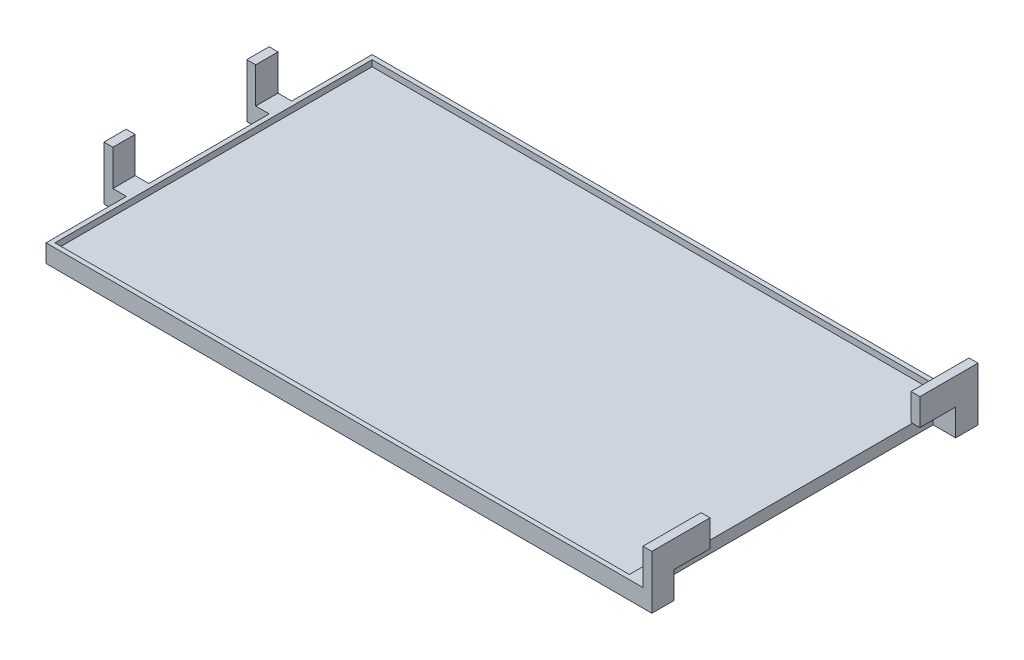
from build123d import *

# Parameters (mm, degrees)
ESQUISSE1_W             = 130.51
ESQUISSE1_H             = 72.96
BOSS_EXTRU_4_DEPTH      = 4
ESQUISSE5_W             = 128.51
ESQUISSE5_H             = 70.96
ENL_V_MAT_EXTRU_1_DEPTH = 1.36
ESQUISSE6_W             = 60.96
ESQUISSE6_H             = 1.36
ENL_V_MAT_EXTRU_2_DEPTH = 149.70104808
ESQUISSE12_W            = 5.045005
ESQUISSE12_H            = 5
BOSS_EXTRU_10_DEPTH     = 4
ESQUISSE14_W            = 2
ESQUISSE14_H            = 5
BOSS_EXTRU_11_DEPTH     = 8
ESQUISSE15_W            = 2
ESQUISSE15_H            = 6
BOSS_EXTRU_12_DEPTH     = 8
ESQUISSE16_W            = 2
ESQUISSE16_H            = 6
BOSS_EXTRU_13_DEPTH     = 8
ESQUISSE17_W            = 5.045005
ESQUISSE17_H            = 5
BOSS_EXTRU_14_DEPTH     = 4
ESQUISSE19_W            = 2
ESQUISSE19_H            = 5
BOSS_EXTRU_15_DEPTH     = 8


with BuildPart() as part:
    # Esquisse1 → Boss.-Extru.4 (new body)
    with BuildSketch(Plane(origin=(0, 0, 0), x_dir=(1, 0, 0), z_dir=(0, 1, 0))):
        with Locations((65.255, 36.48)):
            Rectangle(ESQUISSE1_W, ESQUISSE1_H)
    extrude(amount=BOSS_EXTRU_4_DEPTH)

    # Esquisse5 → Enlèv. mat.-Extru.1 (cut)
    with BuildSketch(Plane(origin=(0, 4, 0), x_dir=(1, 0, 0), z_dir=(0, 1, 0))):
        with Locations((65.255, 36.48)):
            Rectangle(ESQUISSE5_W, ESQUISSE5_H)
    extrude(amount=-ENL_V_MAT_EXTRU_1_DEPTH, mode=Mode.SUBTRACT)

    # Esquisse6 → Enlèv. mat.-Extru.2 (cut, through all)
    with BuildSketch(Plane.ZY.offset(-129.51)):
        with Locations((-36.48, 3.32)):
            Rectangle(ESQUISSE6_W, ESQUISSE6_H)
    extrude(amount=-ENL_V_MAT_EXTRU_2_DEPTH, mode=Mode.SUBTRACT)

    # Esquisse12 → Boss.-Extru.10 (add)
    with BuildSketch(Plane.XZ):
        with Locations((133.0325025, -70.46)):
            Rectangle(ESQUISSE12_W, ESQUISSE12_H)
        with Locations((133.0325025, -2.5)):
            Rectangle(ESQUISSE12_W, ESQUISSE12_H)
    extrude(amount=-BOSS_EXTRU_10_DEPTH)

    # Esquisse14 → Boss.-Extru.11 (add)
    with BuildSketch(Plane(origin=(0, 4, 0), x_dir=(1, 0, 0), z_dir=(0, 1, 0))):
        with Locations((134.555005, 70.46)):
            Rectangle(ESQUISSE14_W, ESQUISSE14_H)
        with Locations((134.555005, 2.5)):
            Rectangle(ESQUISSE14_W, ESQUISSE14_H)
    extrude(amount=BOSS_EXTRU_11_DEPTH)

    # Esquisse15 → Boss.-Extru.12 (add)
    with BuildSketch(Plane(origin=(0, 0, -5), x_dir=(-1, 0, 0), z_dir=(0, 0, -1))):
        with Locations((-134.555005, 9)):
            Rectangle(ESQUISSE15_W, ESQUISSE15_H)
    extrude(amount=BOSS_EXTRU_12_DEPTH)

    # Esquisse16 → Boss.-Extru.13 (add)
    with BuildSketch(Plane.XY.offset(-67.96)):
        with Locations((134.555005, 9)):
            Rectangle(ESQUISSE16_W, ESQUISSE16_H)
    extrude(amount=BOSS_EXTRU_13_DEPTH)

    # Esquisse17 → Boss.-Extru.14 (add)
    with BuildSketch(Plane.XZ):
        with Locations((-2.5225025, -52.46)):
            Rectangle(ESQUISSE17_W, ESQUISSE17_H)
        with Locations((-2.5225025, -20.5)):
            Rectangle(ESQUISSE17_W, ESQUISSE17_H)
    extrude(amount=-BOSS_EXTRU_14_DEPTH)

    # Esquisse19 → Boss.-Extru.15 (add)
    with BuildSketch(Plane(origin=(0, 4, 0), x_dir=(1, 0, 0), z_dir=(0, 1, 0))):
        with Locations((-4.045005, 52.46)):
            Rectangle(ESQUISSE19_W, ESQUISSE19_H)
        with Locations((-4.045005, 20.5)):
            Rectangle(ESQUISSE19_W, ESQUISSE19_H)
    extrude(amount=BOSS_EXTRU_15_DEPTH)


solid = part.part
